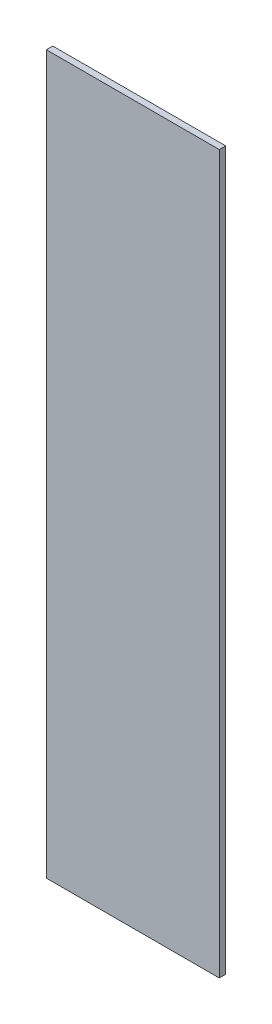
from build123d import *

# Parameters (mm, degrees)
SKETCH1_W           = 342.9
SKETCH1_H           = 1422.4
BOSS_EXTRUDE1_DEPTH = 12.7


with BuildPart() as part:
    # Sketch1 → Boss-Extrude1 (new body)
    with BuildSketch(Plane.XY):
        Rectangle(SKETCH1_W, SKETCH1_H)
    extrude(amount=BOSS_EXTRUDE1_DEPTH)


solid = part.part
